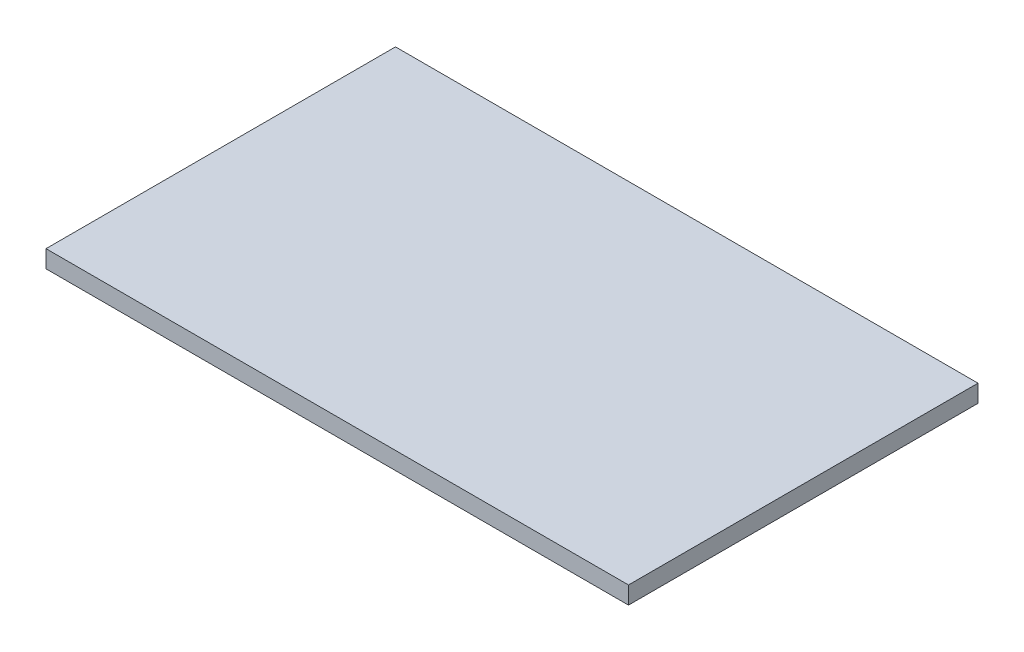
from build123d import *

# Parameters (mm, degrees)
SKETCH1_W           = 100
SKETCH1_H           = 60
BOSS_EXTRUDE1_DEPTH = 3


with BuildPart() as part:
    # Sketch1 → Boss-Extrude1 (new body)
    with BuildSketch(Plane(origin=(0, 0, 0), x_dir=(1, 0, 0), z_dir=(0, 1, 0))):
        Rectangle(SKETCH1_W, SKETCH1_H)
    extrude(amount=BOSS_EXTRUDE1_DEPTH)


solid = part.part
